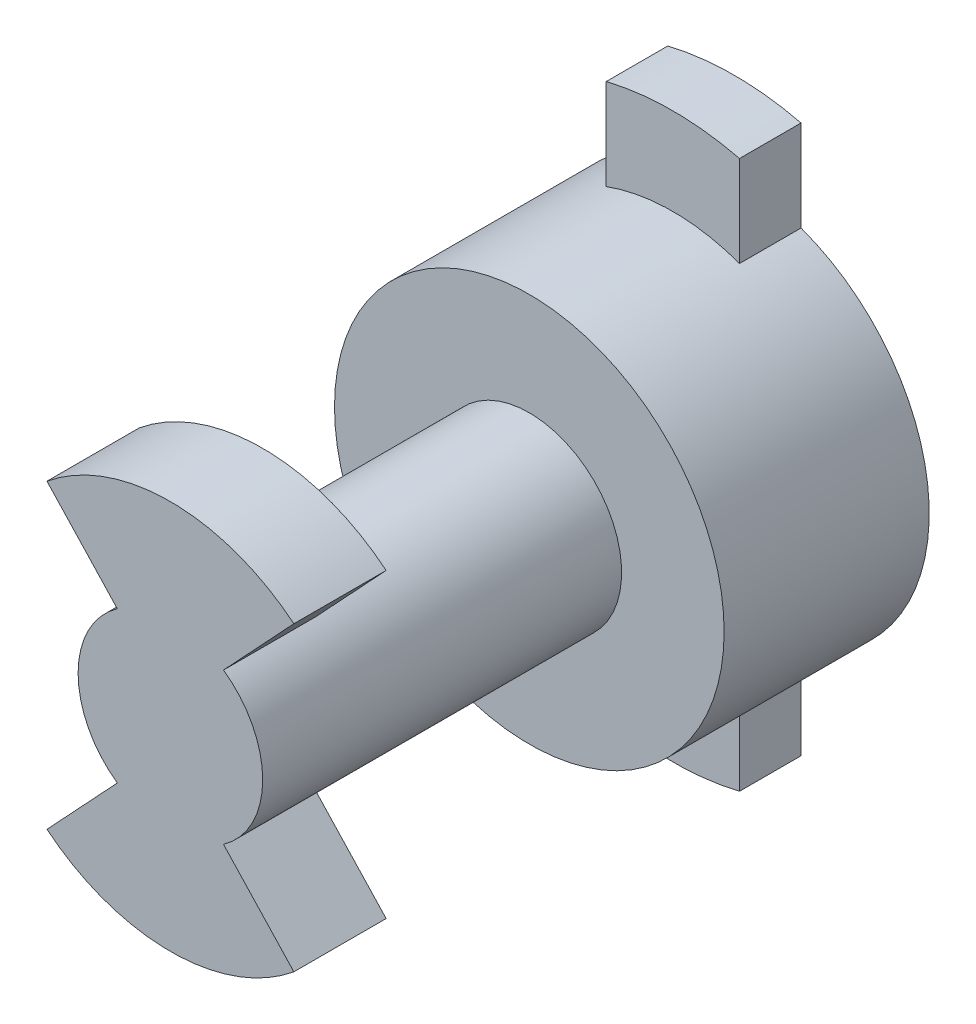
from build123d import *

# Parameters (mm, degrees)
BOSS_EXTRUDE1_DEPTH = 4.5
BOSS_EXTRUDE2_START = -23
BOSS_EXTRUDE2_DEPTH = 23
BOSS_EXTRUDE3_DEPTH = 10
BOSS_EXTRUDE4_DEPTH = 3


with BuildPart() as part:
    # Sketch1 → Boss-Extrude1 (new body)
    with BuildSketch(Plane.XY):
        with BuildLine():
            Line((2.589777271, 3.680088815), (6.019261146, 7.349727563))
            ThreePointArc((6.019261146, 7.349727563), (0, 9.5), (-6.019261146, 7.349727563))
            Line((-6.019261146, 7.349727563), (-2.589777271, 3.680088815))
            ThreePointArc((-2.589777271, 3.680088815), (-4.5, 0), (-2.589777271, -3.680088815))
            Line((-2.589777271, -3.680088815), (-6.019261146, -7.349727563))
            ThreePointArc((-6.019261146, -7.349727563), (0, -9.5), (6.019261146, -7.349727563))
            Line((6.019261146, -7.349727563), (2.589777271, -3.680088815))
            ThreePointArc((2.589777271, -3.680088815), (4.5, 0), (2.589777271, 3.680088815))
        make_face()
    extrude(amount=BOSS_EXTRUDE1_DEPTH)

    # Sketch1<3> → Boss-Extrude2 (add)
    with BuildSketch(Plane.XY.offset(BOSS_EXTRUDE2_START)):
        with BuildLine():
            ThreePointArc((4.5, 0), (3.99399535, 2.073162112), (2.589777271, 3.680088815))
            ThreePointArc((2.589777271, 3.680088815), (0, 4.5), (-2.589777271, 3.680088815))
            ThreePointArc((-2.589777271, 3.680088815), (-4.5, 0), (-2.589777271, -3.680088815))
            ThreePointArc((-2.589777271, -3.680088815), (0, -4.5), (2.589777271, -3.680088815))
            ThreePointArc((2.589777271, -3.680088815), (3.99399535, -2.073162112), (4.5, 0))
        make_face()
    extrude(amount=BOSS_EXTRUDE2_DEPTH)

    # Sketch2 → Boss-Extrude3 (add)
    with BuildSketch(Plane(origin=(0, 0, -23), x_dir=(-1, 0, 0), z_dir=(0, 0, -1))):
        with BuildLine():
            ThreePointArc((-3.25, 8.92561653), (-9.498901539, 0), (-3.25, -8.92561653))
            ThreePointArc((-3.25, -8.92561653), (0, -9.498901539), (3.25, -8.92561653))
            ThreePointArc((3.25, -8.92561653), (7.781406057, -5.447829864), (9.498901539, 0))
            ThreePointArc((9.498901539, 0), (7.781406057, 5.447829864), (3.25, 8.92561653))
            ThreePointArc((3.25, 8.92561653), (0, 9.498901539), (-3.25, 8.92561653))
        make_face()
    extrude(amount=-BOSS_EXTRUDE3_DEPTH)

    # Sketch2<3> → Boss-Extrude4 (add)
    with BuildSketch(Plane(origin=(0, 0, -23), x_dir=(-1, 0, 0), z_dir=(0, 0, -1))):
        with BuildLine():
            ThreePointArc((3.25, -8.92561653), (0, -9.498901539), (-3.25, -8.92561653))
            Line((-3.25, -8.92561653), (-3.25, -13.360389216))
            ThreePointArc((-3.25, -13.360389216), (0, -13.75), (3.25, -13.360389216))
            Line((3.25, -13.360389216), (3.25, -8.92561653))
        make_face()
        with BuildLine():
            Line((-3.25, 13.360389216), (-3.25, 8.92561653))
            ThreePointArc((-3.25, 8.92561653), (0, 9.498901539), (3.25, 8.92561653))
            Line((3.25, 8.92561653), (3.25, 13.360389216))
            ThreePointArc((3.25, 13.360389216), (0, 13.75), (-3.25, 13.360389216))
        make_face()
    extrude(amount=-BOSS_EXTRUDE4_DEPTH)


solid = part.part
